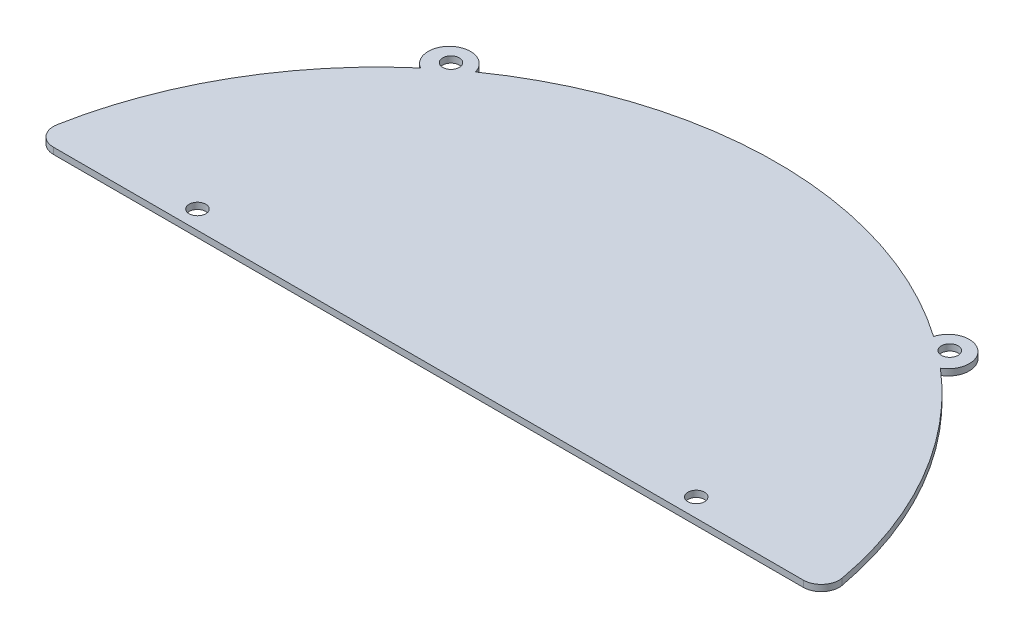
from build123d import *

# Parameters (mm, degrees)
BOSS_EXTRU_1_DEPTH      = 1.524
CONG_1_R                = 4.318
BOSS_EXTRU_3_START      = -1.524
BOSS_EXTRU_3_DEPTH      = 1.524
ESQUISSE3_R             = 2
ENL_V_MAT_EXTRU_1_DEPTH = 127.347243097


with BuildPart() as part:
    # Esquisse1 → Boss.-Extru.1 (new body)
    with BuildSketch(Plane(origin=(0, 0, 0), x_dir=(1, 0, 0), z_dir=(0, 1, 0))):
        with BuildLine():
            Line((-95.25, 0), (95.25, 0))
            ThreePointArc((95.25, 0), (0, 83.82), (-95.25, 0))
        make_face()
    extrude(amount=BOSS_EXTRU_1_DEPTH)

    # Congé1
    cong_1_edges = [part.edges().sort_by_distance(p)[0] for p in [
        (-95.25, 0.762, 0),
        (95.25, 0.762, 0),
    ]]
    fillet(cong_1_edges, radius=CONG_1_R)

    # Esquisse2 → Boss.-Extru.3 (add)
    with BuildSketch(Plane(origin=(0, 1.524, 0), x_dir=(1, 0, 0), z_dir=(0, 1, 0)).offset(BOSS_EXTRU_3_START)):
        with BuildLine():
            ThreePointArc((62.546228877, 60.657678488), (63.115798852, 69.065741324), (55.110603719, 66.431964286))
            ThreePointArc((55.110603719, 66.431964286), (58.899220354, 63.635996718), (62.546228877, 60.657678488))
        make_face()
        with BuildLine():
            ThreePointArc((-62.546228877, 60.657678488), (-58.899220354, 63.635996718), (-55.110603719, 66.431964286))
            ThreePointArc((-55.110603719, 66.431964286), (-63.115798852, 69.065741324), (-62.546228877, 60.657678488))
        make_face()
    extrude(amount=BOSS_EXTRU_3_DEPTH)

    # Esquisse3 → Enlèv. mat.-Extru.1 (cut, through all)
    with BuildSketch(Plane(origin=(0, 1.524, 0), x_dir=(1, 0, 0), z_dir=(0, 1, 0))):
        with Locations(Location((60, 4.445, 0), (0, 0, 270))):
            Circle(ESQUISSE3_R)
        with Locations(Location((-60, 4.445, 0), (0, 0, 270))):
            Circle(ESQUISSE3_R)
        with Locations(Location((-60, 65.445, 0), (0, 0, 270))):
            Circle(ESQUISSE3_R)
        with Locations(Location((60, 65.445, 0), (0, 0, 270))):
            Circle(ESQUISSE3_R)
    extrude(amount=-ENL_V_MAT_EXTRU_1_DEPTH, mode=Mode.SUBTRACT)


solid = part.part
